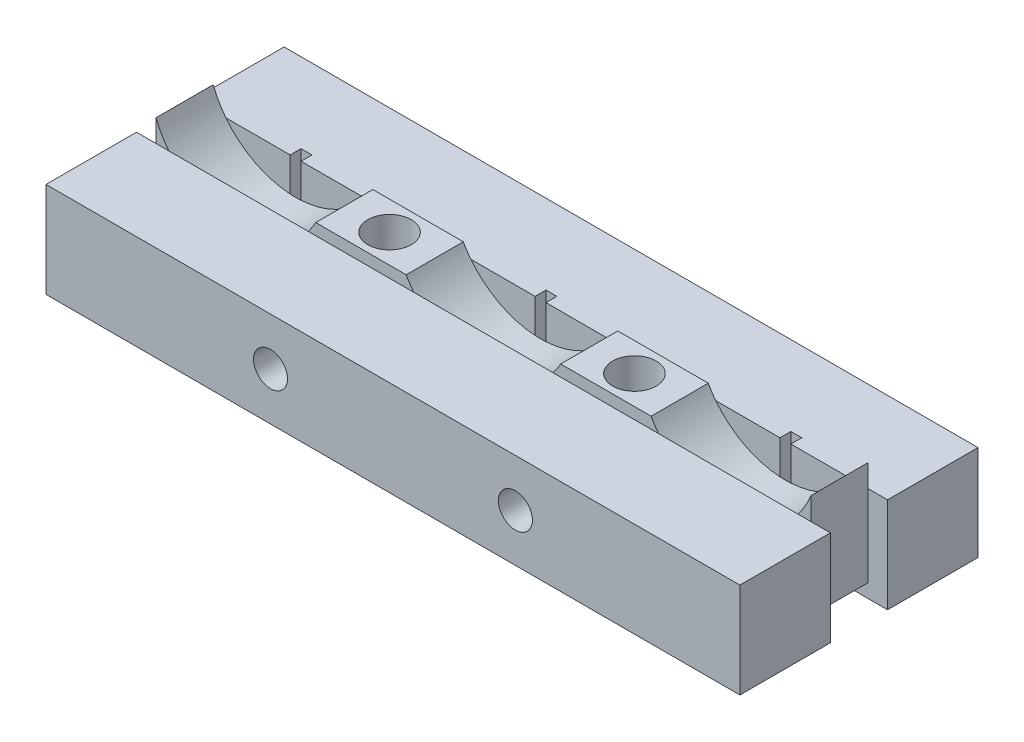
from build123d import *

# Parameters (mm, degrees)
BOSS_EXTRUDE1_DEPTH              = 4.2
SKETCH3_R                        = 1.6
CUT_EXTRUDE3_DEPTH               = 26.650611325
LPATTERN1_COUNT                  = 2
LPATTERN1_PITCH                  = 18
SKETCH6_W                        = 51
SKETCH6_H                        = 7
BOSS_EXTRUDE3_DEPTH              = 6.65
SKETCH7_W                        = 0.8
SKETCH7_H                        = 0.8
CUT_EXTRUDE7_DEPTH               = 28.734190536
SKETCH8_W                        = 51
SKETCH8_H                        = 7
BOSS_EXTRUDE4_DEPTH              = 6.65
TAP_DRILL_FOR_M3_TAP1_AT_2_COUNT = 2
TAP_DRILL_FOR_M3_TAP1_AT_2_PITCH = 18
LPATTERN2_COUNT                  = 2
LPATTERN2_PITCH                  = 36
LPATTERN2_COUNT_DIR2             = 2
LPATTERN2_PITCH_DIR2             = 11.5
SKETCH16_W                       = 48.12122682
SKETCH16_H                       = 4.2
CUT_EXTRUDE8_DEPTH               = 1


with BuildPart() as part:
    # Sketch1 → Boss-Extrude1 (new body)
    with BuildSketch(Plane.XY):
        with BuildLine():
            Line((-12.324882265, -9.164137338), (-5.677872392, -9.164137338))
            ThreePointArc((-5.677872392, -9.164137338), (0, -12.5), (5.677872392, -9.164137338))
            Line((5.677872392, -9.164137338), (12.324882265, -9.164137338))
            ThreePointArc((12.324882265, -9.164137338), (18.449107388, -12.484656447), (24.06061341, -8.356341939))
            Line((24.06061341, -8.356341939), (24.06061341, -17))
            Line((24.06061341, -17), (-24.06061341, -17))
            Line((-24.06061341, -17), (-24.06061341, -8.356341939))
            ThreePointArc((-24.06061341, -8.356341939), (-18.449107388, -12.484656447), (-12.324882265, -9.164137338))
        make_face()
    extrude(amount=BOSS_EXTRUDE1_DEPTH)

    # Sketch3 → Cut-Extrude3 (cut, through all)
    with BuildSketch(Plane(origin=(0, -9.164137338, 0), x_dir=(1, 0, 0), z_dir=(0, 1, 0))):
        with Locations(Location((-9.001377329, -2.1, 0), (0, 0, 270))):
            Circle(SKETCH3_R)
    cut_extrude3 = extrude(amount=-CUT_EXTRUDE3_DEPTH, mode=Mode.SUBTRACT)

    # LPattern1: Cut-Extrude3 ×2
    with Locations(*[(i * LPATTERN1_PITCH, 0, 0) for i in range(1, LPATTERN1_COUNT)]):
        add(cut_extrude3, mode=Mode.SUBTRACT)

    # Sketch6 → Boss-Extrude3 (add)
    with BuildSketch(Plane(origin=(0, 0, 0), x_dir=(-1, 0, 0), z_dir=(0, 0, -1))):
        with Locations((0, -13.5)):
            Rectangle(SKETCH6_W, SKETCH6_H)
    extrude(amount=BOSS_EXTRUDE3_DEPTH)

    # Sketch7 → Cut-Extrude7 (cut, through all)
    with BuildSketch(Plane.XZ.offset(17)):
        with Locations((-0.002754658, 3.8)):
            Rectangle(SKETCH7_W, SKETCH7_H)
        with Locations((-18.002754658, -0.4)):
            Rectangle(SKETCH7_W, SKETCH7_H)
        with Locations((-18.002754658, 3.8)):
            Rectangle(SKETCH7_W, SKETCH7_H)
        with Locations((-0.002754658, -0.4)):
            Rectangle(SKETCH7_W, SKETCH7_H)
        with Locations((17.997245342, 3.8)):
            Rectangle(SKETCH7_W, SKETCH7_H)
        with Locations((17.997245342, -0.4)):
            Rectangle(SKETCH7_W, SKETCH7_H)
    extrude(amount=-CUT_EXTRUDE7_DEPTH, mode=Mode.SUBTRACT)

    # Sketch8 → Boss-Extrude4 (add)
    with BuildSketch(Plane.XY.offset(4.2)):
        with Locations((0, -13.5)):
            Rectangle(SKETCH8_W, SKETCH8_H)
    extrude(amount=BOSS_EXTRUDE4_DEPTH)

    # Sketch13 → Tap Drill for M3 Tap1 (revolve, cut)
    with BuildSketch(Plane(origin=(9, -13.5, -6.65), x_dir=(0, 1, 0), z_dir=(1, 0, 0))):
        Polygon((0, 0), (0, 6.751075774), (1.25, 6), (1.25, 0), align=None)
    tap_drill_for_m3_tap1 = revolve(axis=Axis((9, -13.5, -13), (0, 0, 1)), mode=Mode.SUBTRACT)

    # Tap Drill for M3 Tap1 at 2: Tap Drill for M3 Tap1 ×2
    with Locations(*[(-i * TAP_DRILL_FOR_M3_TAP1_AT_2_PITCH, 0, 0) for i in range(1, TAP_DRILL_FOR_M3_TAP1_AT_2_COUNT)]):
        add(tap_drill_for_m3_tap1, mode=Mode.SUBTRACT)

    # Mirror2: Tap Drill for M3 Tap1 across plane
    add(tap_drill_for_m3_tap1.mirror(Plane.XY.offset(2.1)), mode=Mode.SUBTRACT)

    # Mirror2 copy 1 sketch → Mirror2 copy 1 (revolve, cut)
    with BuildSketch(Plane(origin=(-9, -13.5, 10.85), x_dir=(0, 1, 0), z_dir=(1, 0, 0))):
        Polygon((0, 0), (0, -6.751075774), (1.25, -6), (1.25, 0), align=None)
    revolve(axis=Axis((-9, -13.5, 17.2), (0, 0, 1)), mode=Mode.SUBTRACT)

    # Sketch15 → M3 Tapped Hole3 (revolve, cut)
    with BuildSketch(Plane(origin=(-18, -17, 7.85), x_dir=(0, 0, -1), z_dir=(1, 0, 0))):
        Polygon((0, 0), (0, 6.251075774), (1.25, 5.5), (1.25, 0), align=None)
    m3_tapped_hole3 = revolve(axis=Axis((-18, -23.35, 7.85), (0, 1, 0)), mode=Mode.SUBTRACT)

    # LPattern2: M3 Tapped Hole3 2 × 2
    with Locations(*[(i * LPATTERN2_PITCH, 0, -j * LPATTERN2_PITCH_DIR2) for i in range(LPATTERN2_COUNT) for j in range(LPATTERN2_COUNT_DIR2) if (i, j) != (0, 0)]):
        add(m3_tapped_hole3, mode=Mode.SUBTRACT)

    # Sketch16 → Cut-Extrude8 (cut)
    with BuildSketch(Plane.XZ.offset(17)):
        with Locations((0, 2.1)):
            Rectangle(SKETCH16_W, SKETCH16_H)
    extrude(amount=-CUT_EXTRUDE8_DEPTH, mode=Mode.SUBTRACT)


solid = part.part
